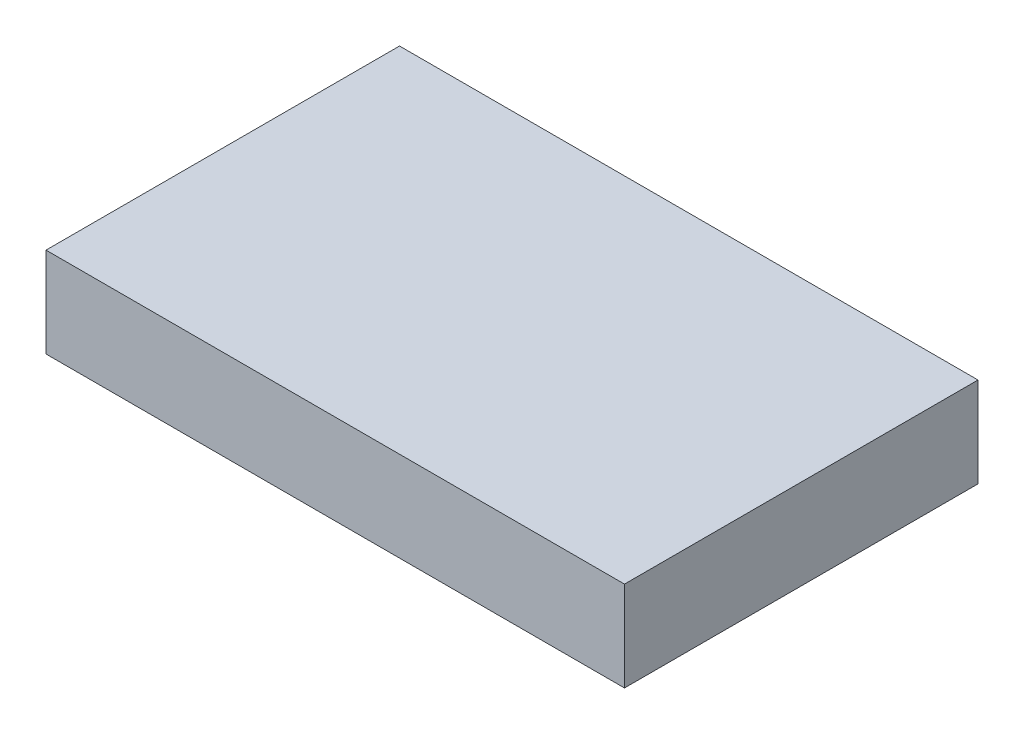
from build123d import *

# Parameters (mm, degrees)
ESBO_O1_W                = 90
ESBO_O1_H                = 14
RESSALTO_EXTRUS_O1_DEPTH = 55


with BuildPart() as part:
    # Esboço1 → Ressalto-extrusão1 (new body)
    with BuildSketch(Plane.XY):
        with Locations((0, 7)):
            Rectangle(ESBO_O1_W, ESBO_O1_H)
    extrude(amount=RESSALTO_EXTRUS_O1_DEPTH)


solid = part.part
